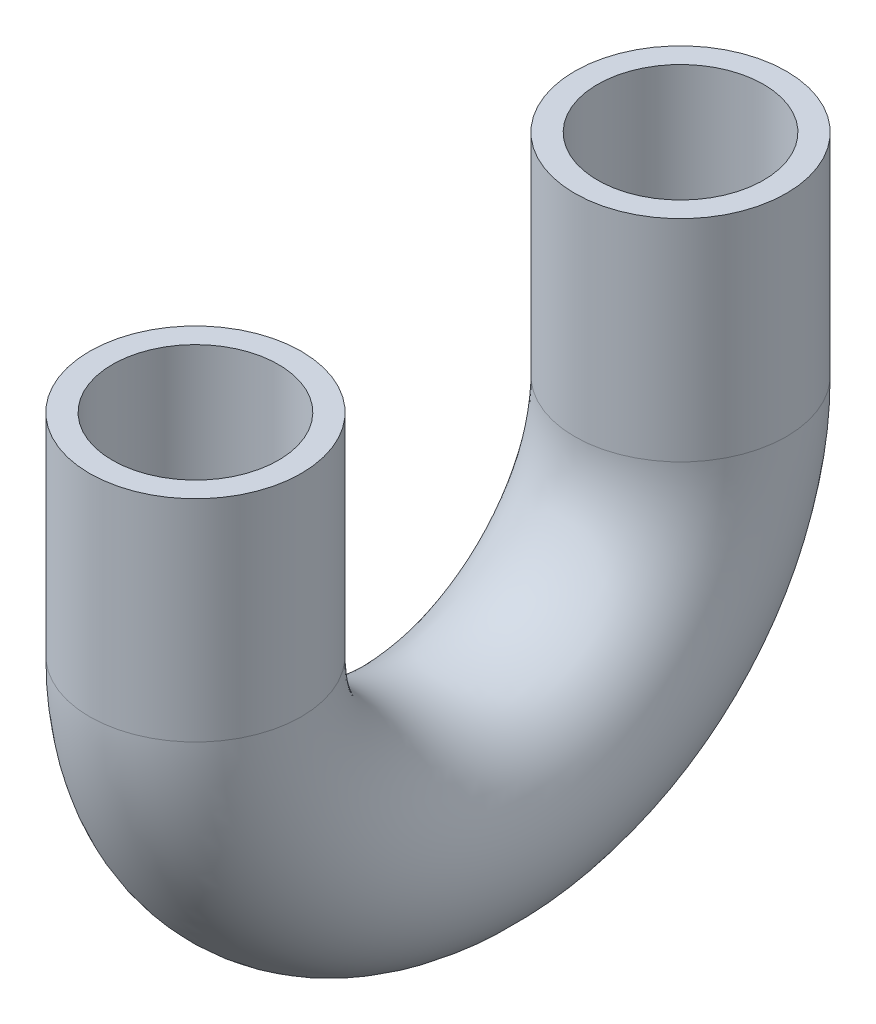
from build123d import *

# Parameters (mm, degrees)
SKETCH1_R   = 43.257251999
SKETCH1_R_2 = 33.930736727


with BuildPart() as part:
    # Sweep1: sweep along a path in Sketch3
    with BuildLine(Plane(origin=(0, 0, 0), x_dir=(0, 0, -1), z_dir=(1, 0, 0))) as sweep1_path:
        Line((0, 0), (0, -86.105678401))
        ThreePointArc((0, -86.105678401), (99.134330473, -185.240008874), (198.268660946, -86.105678401))
        Line((198.268660946, -86.105678401), (198.268660946, 0))
    # Sketch1 → Sweep1 (sweep)
    with BuildSketch(Plane(origin=(0, 0, 0), x_dir=(1, 0, 0), z_dir=(0, 1, 0))):
        Circle(SKETCH1_R)
        Circle(SKETCH1_R_2, mode=Mode.SUBTRACT)
    sweep(path=sweep1_path.line)


solid = part.part
